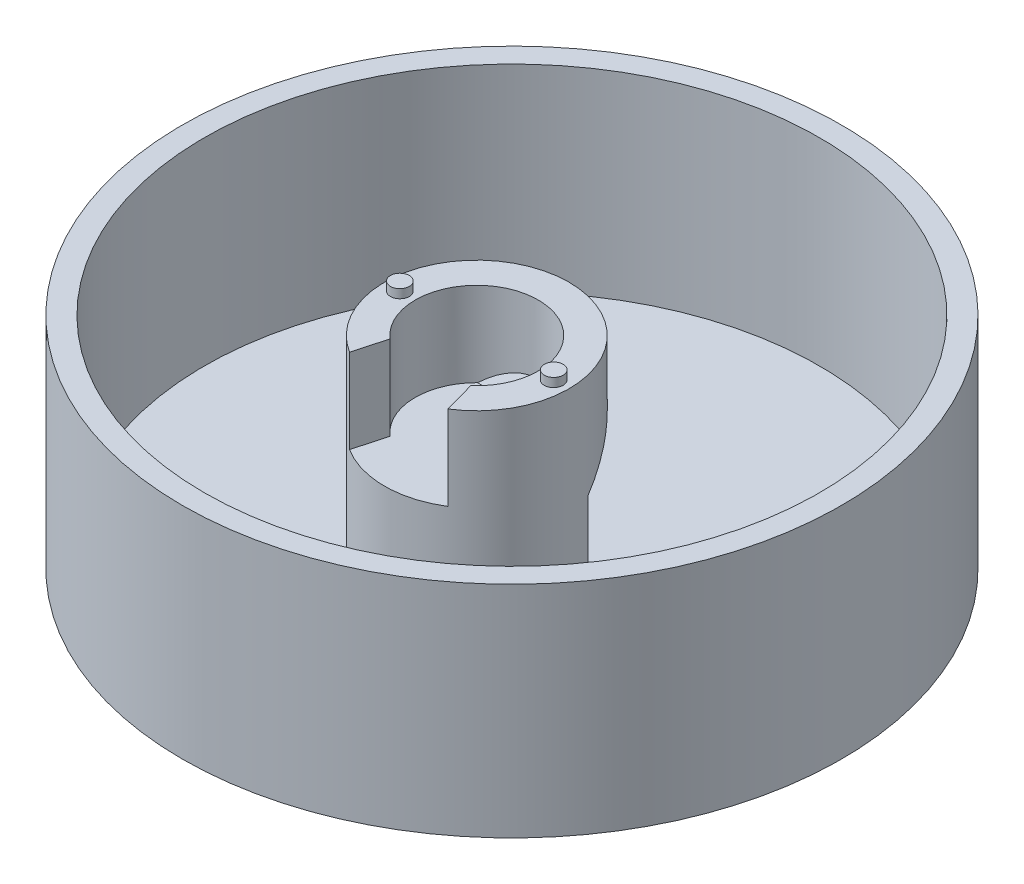
from build123d import *

# Parameters (mm, degrees)
SKETCH1_R               = 75
BOSS_EXTRUDE1_DEPTH     = 50
SHELL1_T                = -5
SKETCH2_R               = 21
BOSS_EXTRUDE2_DEPTH     = 45
CUT_EXTRUDE1_START      = -19.2
CUT_EXTRUDE1_DEPTH      = 19.2
SKETCH3_3_R             = 2.15
BOSS_EXTRUDE3_DEPTH     = 2
CUT_EXTRUDE3_DEPTH      = 32
CUT_EXTRUDE3_DEPTH_BACK = 27


with BuildPart() as part:
    # Sketch1 → Boss-Extrude1 (new body)
    with BuildSketch(Plane(origin=(0, 0, 0), x_dir=(1, 0, 0), z_dir=(0, 1, 0))):
        with Locations(Location((0, 0, 0), (0, 0, 270))):
            Circle(SKETCH1_R)
    extrude(amount=BOSS_EXTRUDE1_DEPTH)

    # Shell1
    shell1_openings = [part.faces().sort_by_distance(p)[0] for p in [
        (0, 50, 0),
    ]]
    offset(amount=SHELL1_T, openings=shell1_openings, kind=Kind.INTERSECTION)

    # Sketch2 → Boss-Extrude2 (add)
    with BuildSketch(Plane(origin=(0, 5, 0), x_dir=(1, 0, 0), z_dir=(0, 1, 0))):
        with Locations(Location((0, -8, 0), (0, 0, 270))):
            Circle(SKETCH2_R)
    extrude(amount=BOSS_EXTRUDE2_DEPTH)

    # Sketch3 → Cut-Extrude1 (cut)
    with BuildSketch(Plane(origin=(0, 50, 0), x_dir=(1, 0, 0), z_dir=(0, 1, 0)).offset(CUT_EXTRUDE1_START)):
        with BuildLine():
            Line((11.193269132, -25.768250508), (9.2, -18.552724767))
            ThreePointArc((9.2, -18.552724767), (0, 6), (-9.2, -18.552724767))
            Line((-9.2, -18.552724767), (-11.193269132, -25.768250508))
            ThreePointArc((-11.193269132, -25.768250508), (0, -29), (11.193269132, -25.768250508))
        make_face()
    extrude(amount=CUT_EXTRUDE1_DEPTH, mode=Mode.SUBTRACT)

    # Sketch3<3> → Boss-Extrude3 (add)
    with BuildSketch(Plane(origin=(0, 50, 0), x_dir=(1, 0, 0), z_dir=(0, 1, 0))):
        with Locations(Location((-17.5, -8, 0), (0, 0, 270))):
            Circle(SKETCH3_3_R)
        with Locations(Location((17.5, -8, 0), (0, 0, 270))):
            Circle(SKETCH3_3_R)
    extrude(amount=BOSS_EXTRUDE3_DEPTH)

    # Sketch6 → Cut-Extrude3 (cut, two sides: drawn at the far end of the back side and taken through both)
    with BuildSketch(Plane(origin=(0, 50, -13), x_dir=(0, 0, 1), z_dir=(-1, 0, 0)).offset(-CUT_EXTRUDE3_DEPTH_BACK)):
        Polygon((-3.408673703, -45), (16.182064941, -45), (16.182064941, -23.856535334), (0, -9.257667594), (-3.408673703, -9.257667594), align=None)
    extrude(amount=CUT_EXTRUDE3_DEPTH + CUT_EXTRUDE3_DEPTH_BACK, mode=Mode.SUBTRACT)


solid = part.part
